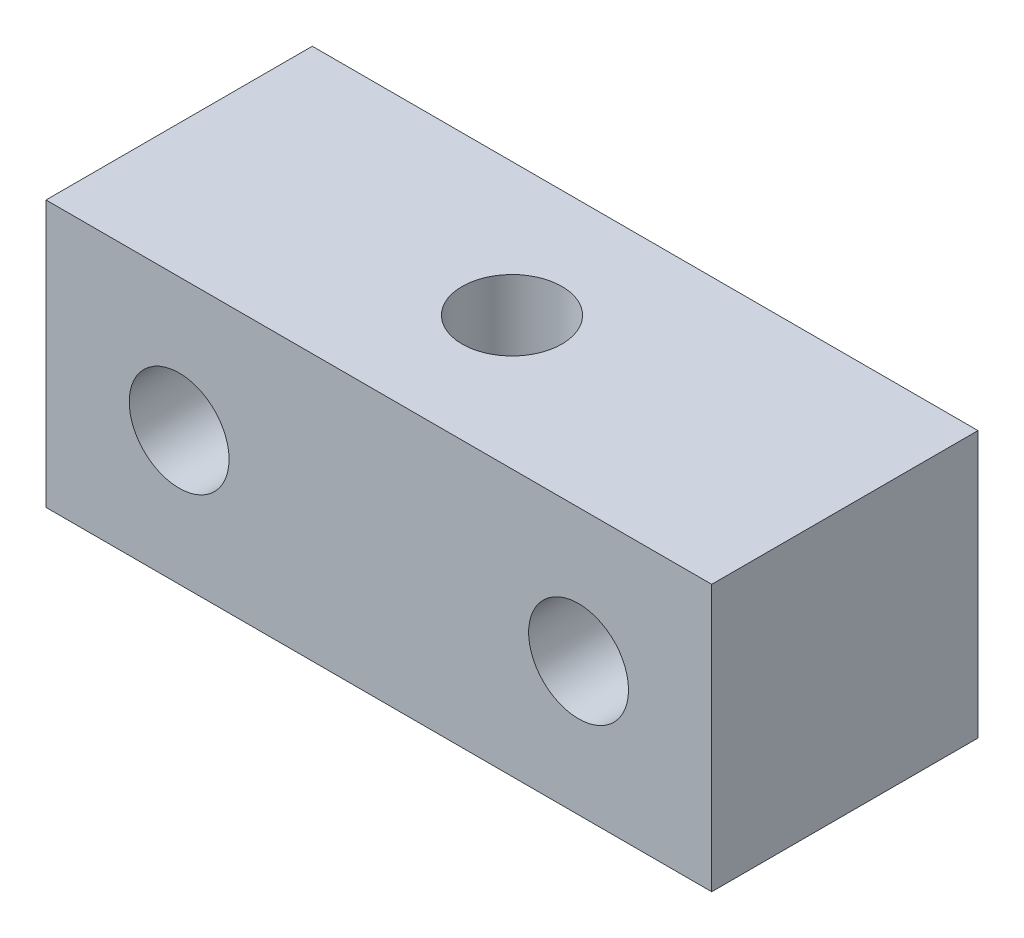
from build123d import *

# Parameters (mm, degrees)
SKETCH_1_W          = 8
SKETCH_1_H          = 8
EXTRUDE_1_DEPTH     = 20
SKETCH_3_R          = 1.5
CUT_EXTRUDE_1_DEPTH = 23.978250586
SKETCH_5_R          = 1.5
CUT_EXTRUDE_2_DEPTH = 23.978250586


with BuildPart() as part:
    # 草图1 → 凸台-拉伸1 (new body)
    with BuildSketch(Plane(origin=(0, 0, 0), x_dir=(0, 0, -1), z_dir=(1, 0, 0))):
        with Locations((4, 4)):
            Rectangle(SKETCH_1_W, SKETCH_1_H)
    extrude(amount=EXTRUDE_1_DEPTH)

    # 草图3 → 切除-拉伸1 (cut, through all)
    with BuildSketch(Plane.XY):
        with Locations((4, 4)):
            Circle(SKETCH_3_R)
        with Locations((16, 4)):
            Circle(SKETCH_3_R)
    extrude(amount=-CUT_EXTRUDE_1_DEPTH, mode=Mode.SUBTRACT)

    # 草图5 → 切除-拉伸2 (cut, through all)
    with BuildSketch(Plane(origin=(0, 8, 0), x_dir=(1, 0, 0), z_dir=(0, 1, 0))):
        with Locations(Location((10, 4, 0), (0, 0, 270))):
            Circle(SKETCH_5_R)
    extrude(amount=-CUT_EXTRUDE_2_DEPTH, mode=Mode.SUBTRACT)


solid = part.part
